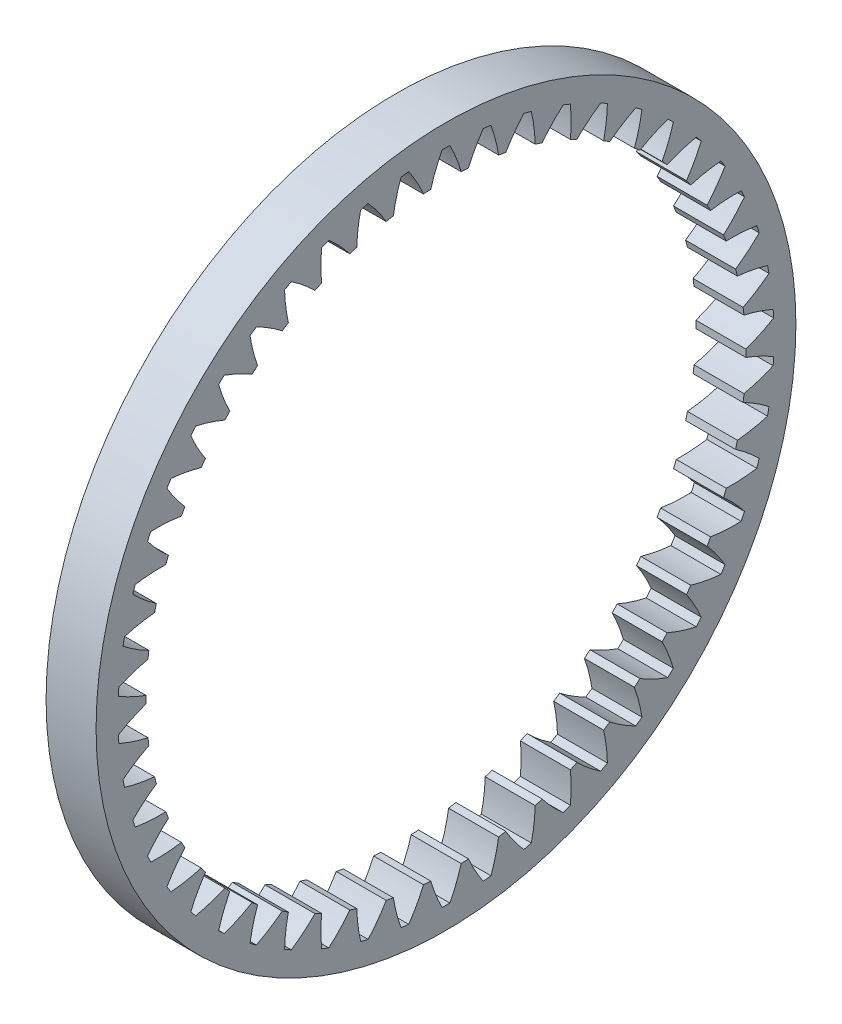
from build123d import *

# Parameters (mm, degrees)
BASPROSKE_W     = 12.7
BASPROSKE_H     = 12.7
TOOTHCUT_DEPTH  = 127.363404513
TEETHCUTS_COUNT = 50
TEETHCUTS_ANGLE = 352.8


with BuildPart() as part:
    # BasProSke → Base-Revolve (revolve)
    with BuildSketch(Plane(origin=(0, 0, 0), x_dir=(1, 0, 0), z_dir=(0, 1, 0)), mode=Mode.PRIVATE) as base_revolve_sk:
        with Locations((6.35, 82.55)):
            Rectangle(BASPROSKE_W, BASPROSKE_H)
    revolve(base_revolve_sk.sketch.rotate(Axis((-10, 0, 0), (1, 0, 0)), 180), axis=Axis((-10, 0, 0), (1, 0, 0)))

    # TooCutSke → ToothCut (cut, through all)
    with BuildSketch(Plane(origin=(0, 0, 0), x_dir=(0, 0, -1), z_dir=(1, 0, 0))):
        with BuildLine():
            ThreePointArc((3.867790154, 76.076342476), (2.602004681, 79.779140388), (0.977721518, 83.339284971))
            ThreePointArc((0.977721518, 83.339284971), (0, 83.34502), (-0.977721518, 83.339284971))
            ThreePointArc((-0.977721518, 83.339284971), (-2.602004681, 79.779140388), (-3.867790154, 76.076342476))
            ThreePointArc((-3.867790154, 76.076342476), (0, 76.1746), (3.867790154, 76.076342476))
        make_face()
    toothcut = extrude(amount=TOOTHCUT_DEPTH, mode=Mode.SUBTRACT)

    # TeethCuts: ToothCut ×50 about axis
    teethcuts_axis = Axis((-10, 0, 0), (1, 0, 0))
    for i in range(1, TEETHCUTS_COUNT):
        add(toothcut.rotate(teethcuts_axis, i * TEETHCUTS_ANGLE / (TEETHCUTS_COUNT - 1)), mode=Mode.SUBTRACT)


solid = part.part
